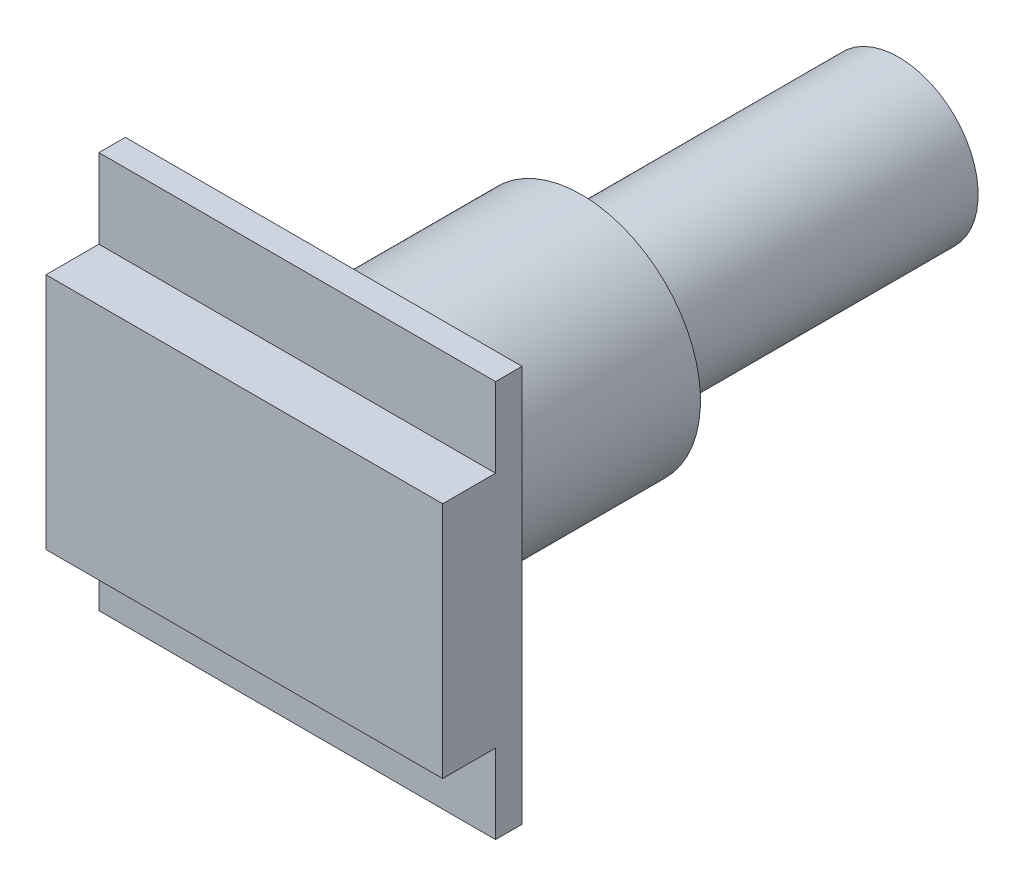
from build123d import *

# Parameters (mm, degrees)
IZIM1_W                     = 30
IZIM1_H                     = 30
Y_KSEKLIK_EKSTR_ZYON1_DEPTH = 6
IZIM2_W                     = 30
IZIM2_H                     = 6
KES_EKSTR_ZYON1_DEPTH       = 4
IZIM3_W                     = 30
IZIM3_H                     = 6
KES_EKSTR_ZYON2_DEPTH       = 4
IZIM4_R                     = 9
Y_KSEKLIK_EKSTR_ZYON2_DEPTH = 19.5
IZIM5_R                     = 6
Y_KSEKLIK_EKSTR_ZYON3_DEPTH = 24


with BuildPart() as part:
    # Çizim1 → Yükseklik-Ekstrüzyon1 (new body)
    with BuildSketch(Plane.XY):
        with Locations((-24.193211068, 8.69047619)):
            Rectangle(IZIM1_W, IZIM1_H)
    extrude(amount=Y_KSEKLIK_EKSTR_ZYON1_DEPTH)

    # Çizim2 → Kes-Ekstrüzyon1 (cut)
    with BuildSketch(Plane.XY.offset(6)):
        with Locations((-24.193211068, -3.30952381)):
            Rectangle(IZIM2_W, IZIM2_H)
    extrude(amount=-KES_EKSTR_ZYON1_DEPTH, mode=Mode.SUBTRACT)

    # Çizim3 → Kes-Ekstrüzyon2 (cut)
    with BuildSketch(Plane.XY.offset(6)):
        with Locations((-24.193211068, 20.69047619)):
            Rectangle(IZIM3_W, IZIM3_H)
    extrude(amount=-KES_EKSTR_ZYON2_DEPTH, mode=Mode.SUBTRACT)

    # Çizim4 → Yükseklik-Ekstrüzyon2 (add)
    with BuildSketch(Plane(origin=(0, 0, 0), x_dir=(-1, 0, 0), z_dir=(0, 0, -1))):
        with Locations((24.193211068, 8.69047619)):
            Circle(IZIM4_R)
    extrude(amount=Y_KSEKLIK_EKSTR_ZYON2_DEPTH)

    # Çizim5 → Yükseklik-Ekstrüzyon3 (add)
    with BuildSketch(Plane(origin=(0, 0, -19.5), x_dir=(-1, 0, 0), z_dir=(0, 0, -1))):
        with Locations((24.193211068, 8.69047619)):
            Circle(IZIM5_R)
    extrude(amount=Y_KSEKLIK_EKSTR_ZYON3_DEPTH)


solid = part.part
